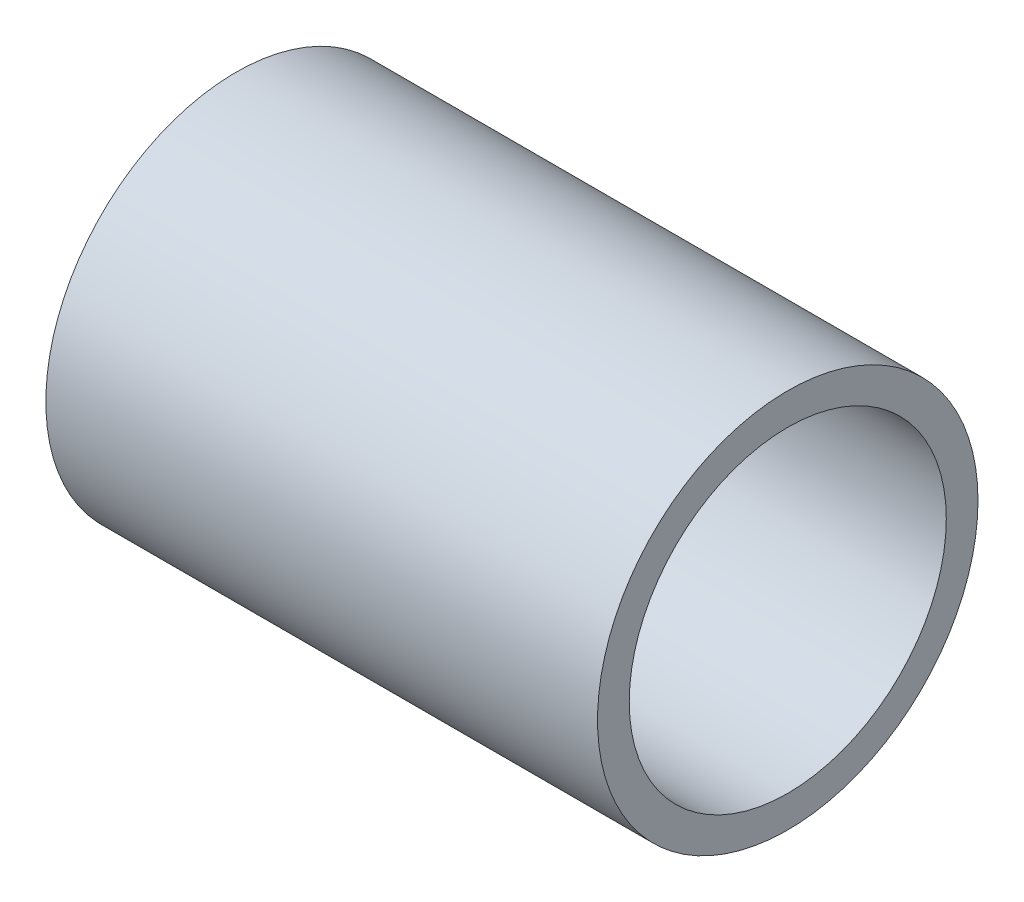
from build123d import *

# Parameters (mm, degrees)
SKETCH1_R           = 6
SKETCH1_R_2         = 5
BOSS_EXTRUDE1_DEPTH = 17.4


with BuildPart() as part:
    # Sketch1 → Boss-Extrude1 (new body)
    with BuildSketch(Plane(origin=(0, 0, 0), x_dir=(0, 0, -1), z_dir=(1, 0, 0))):
        Circle(SKETCH1_R)
        Circle(SKETCH1_R_2, mode=Mode.SUBTRACT)
    extrude(amount=BOSS_EXTRUDE1_DEPTH)


solid = part.part
